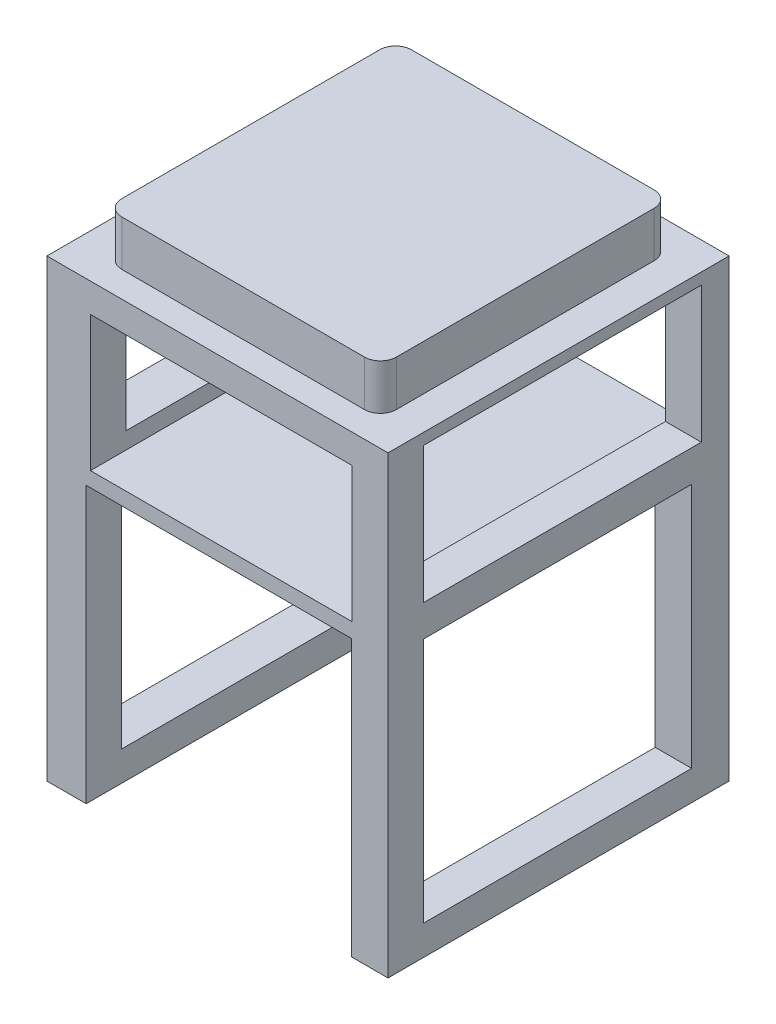
from build123d import *

# Parameters (mm, degrees)
CROQUIS1_W              = 1500
CROQUIS1_H              = 1500
SALIENTE_EXTRUIR1_DEPTH = 2000
CROQUIS2_W              = 1150.952774515
CROQUIS2_H              = 594.8596712
CORTAR_EXTRUIR1_DEPTH   = 2000
CROQUIS3_W              = 1221.848688805
CROQUIS3_H              = 598.28453038
CORTAR_EXTRUIR2_DEPTH   = 2000
CROQUIS6_W              = 1179.446326032
CROQUIS6_H              = 1082.065828189
CORTAR_EXTRUIR5_DEPTH   = 2000
CROQUIS7_W              = 1167.076161376
CROQUIS7_H              = 1212.770202706
CORTAR_EXTRUIR6_DEPTH   = 2000
SALIENTE_EXTRUIR2_DEPTH = 200


with BuildPart() as part:
    # Croquis1 → Saliente-Extruir1 (new body)
    with BuildSketch(Plane(origin=(0, 0, 0), x_dir=(1, 0, 0), z_dir=(0, 1, 0))):
        Rectangle(CROQUIS1_W, CROQUIS1_H)
    extrude(amount=SALIENTE_EXTRUIR1_DEPTH)

    # Croquis2 → Cortar-Extruir1 (cut)
    with BuildSketch(Plane.XY.offset(750)):
        with Locations((16.925070171, 1575.576244906)):
            Rectangle(CROQUIS2_W, CROQUIS2_H)
    extrude(amount=-CORTAR_EXTRUIR1_DEPTH, mode=Mode.SUBTRACT)

    # Croquis3 → Cortar-Extruir2 (cut)
    with BuildSketch(Plane(origin=(750, 0, 0), x_dir=(0, 0, -1), z_dir=(1, 0, 0))):
        with Locations((16.853085362, 1650.950422139)):
            Rectangle(CROQUIS3_W, CROQUIS3_H)
    extrude(amount=-CORTAR_EXTRUIR2_DEPTH, mode=Mode.SUBTRACT)

    # Croquis6 → Cortar-Extruir5 (cut)
    with BuildSketch(Plane(origin=(750, 0, 0), x_dir=(0, 0, -1), z_dir=(1, 0, 0))):
        with Locations((-4.368319726, 671.737288611)):
            Rectangle(CROQUIS6_W, CROQUIS6_H)
    extrude(amount=-CORTAR_EXTRUIR5_DEPTH, mode=Mode.SUBTRACT)

    # Croquis7 → Cortar-Extruir6 (cut)
    with BuildSketch(Plane.XY.offset(750)):
        with Locations((6.319907011, 606.385101353)):
            Rectangle(CROQUIS7_W, CROQUIS7_H)
    extrude(amount=-CORTAR_EXTRUIR6_DEPTH, mode=Mode.SUBTRACT)

    # Croquis10 → Saliente-Extruir2 (add)
    with BuildSketch(Plane(origin=(0, 2000, 0), x_dir=(1, 0, 0), z_dir=(0, 1, 0))):
        with BuildLine():
            Line((-533.551119556, 636.730631364), (533.551119556, 636.730631364))
            ThreePointArc((533.551119556, 636.730631364), (583.048594239, 616.228106047), (603.551119556, 566.730631364))
            Line((603.551119556, 566.730631364), (603.551119556, -566.730631364))
            ThreePointArc((603.551119556, -566.730631364), (583.048594239, -616.228106047), (533.551119556, -636.730631364))
            Line((533.551119556, -636.730631364), (-533.551119556, -636.730631364))
            ThreePointArc((-533.551119556, -636.730631364), (-583.048594239, -616.228106047), (-603.551119556, -566.730631364))
            Line((-603.551119556, -566.730631364), (-603.551119556, 566.730631364))
            ThreePointArc((-603.551119556, 566.730631364), (-583.048594239, 616.228106047), (-533.551119556, 636.730631364))
        make_face()
    extrude(amount=SALIENTE_EXTRUIR2_DEPTH)


solid = part.part
